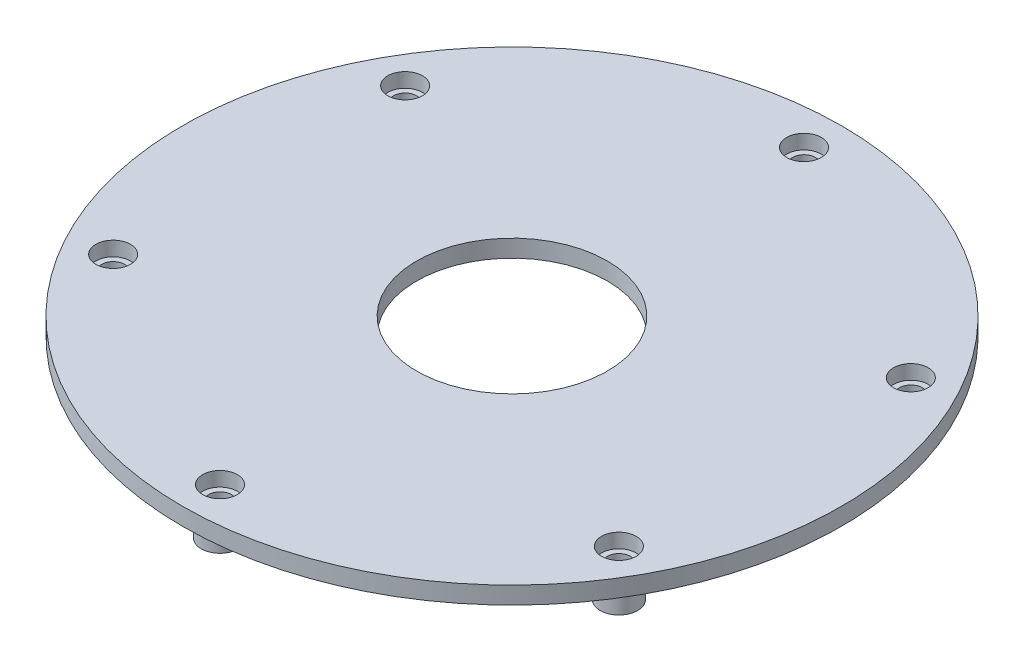
from build123d import *

# Parameters (mm, degrees)
SKETCH1_R           = 57
BOSS_EXTRUDE1_DEPTH = 3
SKETCH2_R           = 2
CUT_EXTRUDE1_DEPTH  = 81.665977958
CIRPATTERN1_COUNT   = 6
SKETCH5_R           = 3.25
BOSS_EXTRUDE2_DEPTH = 5
SKETCH4_R           = 16.5
CUT_EXTRUDE3_DEPTH  = 81.765091469
SKETCH8_R           = 2
CUT_EXTRUDE4_DEPTH  = 82.006172604
SKETCH9_R           = 3
CUT_EXTRUDE5_DEPTH  = 2.5


with BuildPart() as part:
    # Sketch1 → Boss-Extrude1 (new body)
    with BuildSketch(Plane(origin=(0, 0, 0), x_dir=(1, 0, 0), z_dir=(0, 1, 0))):
        with Locations(Location((0, 0, 0), (0, 0, 270))):
            Circle(SKETCH1_R)
    extrude(amount=BOSS_EXTRUDE1_DEPTH)

    # Sketch2 → Cut-Extrude1 (cut, through all)
    with BuildSketch(Plane(origin=(0, 3, 0), x_dir=(1, 0, 0), z_dir=(0, 1, 0))):
        with Locations(Location((0, 50.5, 0), (0, 0, 270))):
            Circle(SKETCH2_R)
    cut_extrude1 = extrude(amount=-CUT_EXTRUDE1_DEPTH, mode=Mode.SUBTRACT)

    # CirPattern1: Cut-Extrude1 ×6 about axis
    cirpattern1_axis = Axis((0, 0, 0), (0, 1, 0))
    for i in range(1, CIRPATTERN1_COUNT):
        add(cut_extrude1.rotate(cirpattern1_axis, i * 360 / CIRPATTERN1_COUNT), mode=Mode.SUBTRACT)

    # Sketch5 → Boss-Extrude2 (add)
    with BuildSketch(Plane.XZ):
        with Locations(Location((0, 50.5, 0), (0, 0, 90))):
            Circle(SKETCH5_R)
        with Locations(Location((43.734282891, 25.25, 0), (0, 0, 90))):
            Circle(SKETCH5_R)
        with Locations(Location((43.734282891, -25.25, 0), (0, 0, 90))):
            Circle(SKETCH5_R)
        with Locations(Location((0, -50.5, 0), (0, 0, 90))):
            Circle(SKETCH5_R)
        with Locations(Location((-43.734282891, -25.25, 0), (0, 0, 90))):
            Circle(SKETCH5_R)
        with Locations(Location((-43.734282891, 25.25, 0), (0, 0, 90))):
            Circle(SKETCH5_R)
    extrude(amount=BOSS_EXTRUDE2_DEPTH)

    # Sketch4 → Cut-Extrude3 (cut, through all)
    with BuildSketch(Plane.XZ):
        with Locations(Location((0, 0, 0), (0, 0, 270))):
            Circle(SKETCH4_R)
    extrude(amount=-CUT_EXTRUDE3_DEPTH, mode=Mode.SUBTRACT)

    # Sketch8 → Cut-Extrude4 (cut, through all)
    with BuildSketch(Plane(origin=(0, 3, 0), x_dir=(1, 0, 0), z_dir=(0, 1, 0))):
        with Locations(Location((-43.734282891, -25.25, 0), (0, 0, 270))):
            Circle(SKETCH8_R)
        with Locations(Location((0, -50.5, 0), (0, 0, 270))):
            Circle(SKETCH8_R)
        with Locations(Location((43.734282891, -25.25, 0), (0, 0, 270))):
            Circle(SKETCH8_R)
        with Locations(Location((43.734282891, 25.25, 0), (0, 0, 270))):
            Circle(SKETCH8_R)
        with Locations(Location((0, 50.5, 0), (0, 0, 270))):
            Circle(SKETCH8_R)
        with Locations(Location((-43.734282891, 25.25, 0), (0, 0, 270))):
            Circle(SKETCH8_R)
    extrude(amount=-CUT_EXTRUDE4_DEPTH, mode=Mode.SUBTRACT)

    # Sketch9 → Cut-Extrude5 (cut)
    with BuildSketch(Plane(origin=(0, 3, 0), x_dir=(1, 0, 0), z_dir=(0, 1, 0))):
        with Locations(Location((-43.734282891, 25.25, 0), (0, 0, 270))):
            Circle(SKETCH9_R)
        with Locations(Location((0, 50.5, 0), (0, 0, 270))):
            Circle(SKETCH9_R)
        with Locations(Location((43.734282891, 25.25, 0), (0, 0, 270))):
            Circle(SKETCH9_R)
        with Locations(Location((43.734282891, -25.25, 0), (0, 0, 270))):
            Circle(SKETCH9_R)
        with Locations(Location((0, -50.5, 0), (0, 0, 270))):
            Circle(SKETCH9_R)
        with Locations(Location((-43.734282891, -25.25, 0), (0, 0, 270))):
            Circle(SKETCH9_R)
    extrude(amount=-CUT_EXTRUDE5_DEPTH, mode=Mode.SUBTRACT)


solid = part.part
